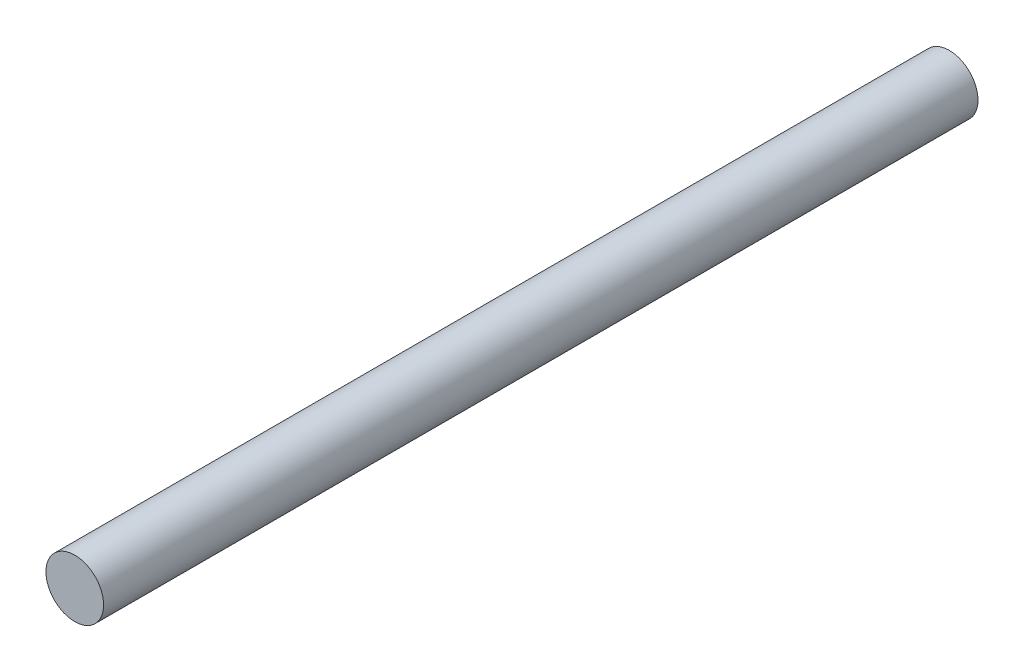
from build123d import *

# Parameters (mm, degrees)
SKETCH1_R           = 3
BOSS_EXTRUDE1_DEPTH = 91


with BuildPart() as part:
    # Sketch1 → Boss-Extrude1 (new body)
    with BuildSketch(Plane.XY):
        Circle(SKETCH1_R)
    extrude(amount=BOSS_EXTRUDE1_DEPTH)


solid = part.part
